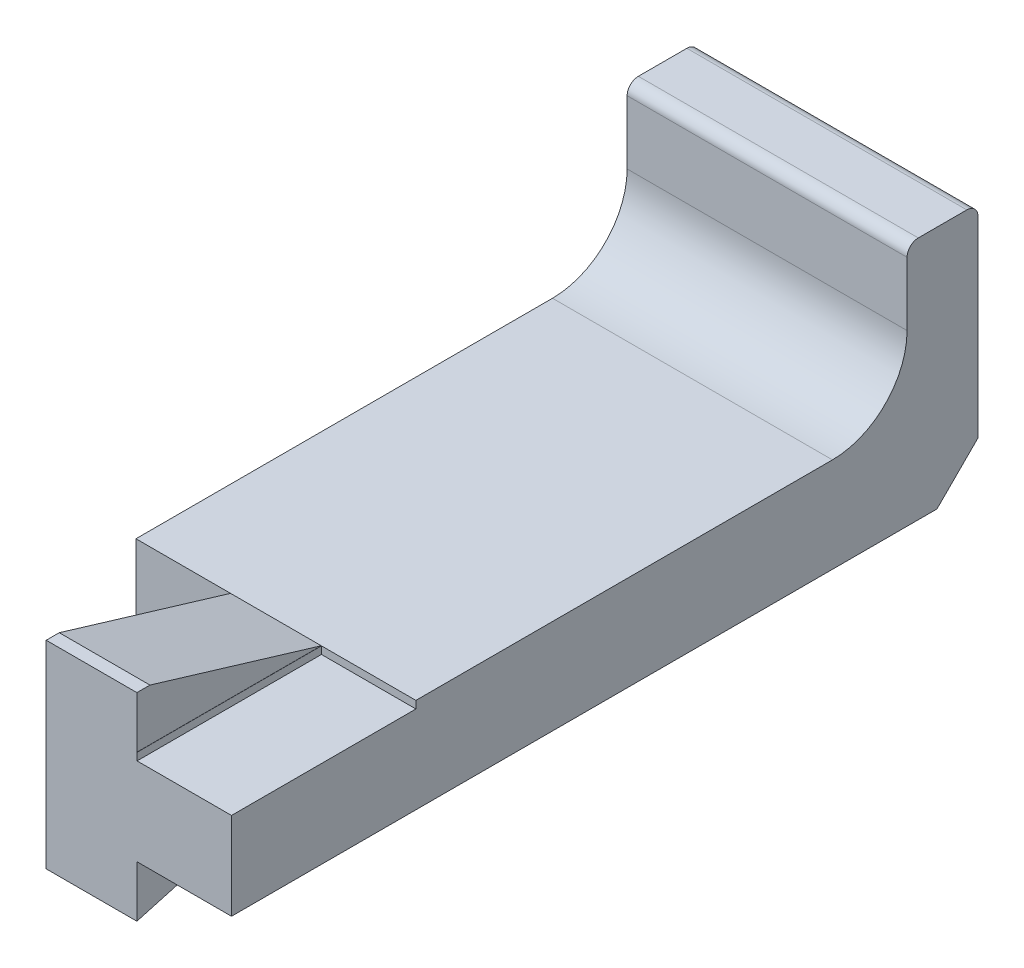
from build123d import *

# Parameters (mm, degrees)
BOSS_EXTRUDE1_DEPTH = 6.4516
SKETCH2_W           = 19.05
SKETCH2_H           = 4.826
BOSS_EXTRUDE2_DEPTH = 10.16
FILLET1_R           = 5.08
FILLET2_R           = 0.762
SKETCH4_W           = 6.4262
SKETCH4_H           = 12.5476
CUT_EXTRUDE1_DEPTH  = 0.508
BOSS_EXTRUDE3_DEPTH = 3.0861
CHAMFER1_SIZE       = 2.794
CUT_EXTRUDE2_DEPTH  = 3.556


with BuildPart() as part:
    # Sketch1 → Boss-Extrude1 (new body)
    with BuildSketch(Plane(origin=(0, 0, 0), x_dir=(1, 0, 0), z_dir=(0, 1, 0))):
        Polygon((-3.0988, -12.8524), (-3.0988, -25.4), (9.525, -25.4), (9.525, 25.4), (-9.525, 25.4), (-9.525, -12.8524), align=None)
    extrude(amount=BOSS_EXTRUDE1_DEPTH)

    # Sketch2 → Boss-Extrude2 (add)
    with BuildSketch(Plane(origin=(0, 6.4516, 0), x_dir=(1, 0, 0), z_dir=(0, 1, 0))):
        with Locations((0, 22.987)):
            Rectangle(SKETCH2_W, SKETCH2_H)
    extrude(amount=BOSS_EXTRUDE2_DEPTH)

    # Fillet1
    fillet1_edges = [part.edges().sort_by_distance(p)[0] for p in [
        (0, 6.4516, -20.574),
    ]]
    fillet(fillet1_edges, radius=FILLET1_R)

    # Fillet2
    fillet2_edges = [part.edges().sort_by_distance(p)[0] for p in [
        (0, 16.6116, -20.574),
        (0, 16.6116, -25.4),
    ]]
    fillet(fillet2_edges, radius=FILLET2_R)

    # Sketch4 → Cut-Extrude1 (cut)
    with BuildSketch(Plane(origin=(0, 6.4516, 0), x_dir=(1, 0, 0), z_dir=(0, 1, 0))):
        with Locations((6.3119, -19.1262)):
            Rectangle(SKETCH4_W, SKETCH4_H)
    extrude(amount=-CUT_EXTRUDE1_DEPTH, mode=Mode.SUBTRACT)

    # Sketch5 → Boss-Extrude3 (add, symmetric)
    with BuildSketch(Plane(origin=(0, 0, 0), x_dir=(0, 0, -1), z_dir=(1, 0, 0))):
        Polygon((-25.4, 6.4516), (-12.8524, 6.4516), (-24.511, 9.96315), (-25.4, 9.96315), align=None)
        Polygon((-25.4, 0), (-25.4, -3.51155), (-12.8524, 0), align=None)
    extrude(amount=BOSS_EXTRUDE3_DEPTH, both=True)

    # Chamfer1
    chamfer1_edges = [part.edges().sort_by_distance(p)[0] for p in [
        (0, 0, -25.4),
    ]]
    chamfer(chamfer1_edges, length=CHAMFER1_SIZE)

    # Sketch6 → Cut-Extrude2 (cut)
    with BuildSketch(Plane.XZ):
        Polygon((3.175, 23.851678881), (7.239, 23.851678881), (7.239, -21.9964), (-7.239, -21.9964), (-7.239, 10.702998039), (-3.175, 10.702998039), (-3.175, 1.273136021), (3.175, 1.273136021), align=None)
    extrude(amount=-CUT_EXTRUDE2_DEPTH, mode=Mode.SUBTRACT)


solid = part.part
